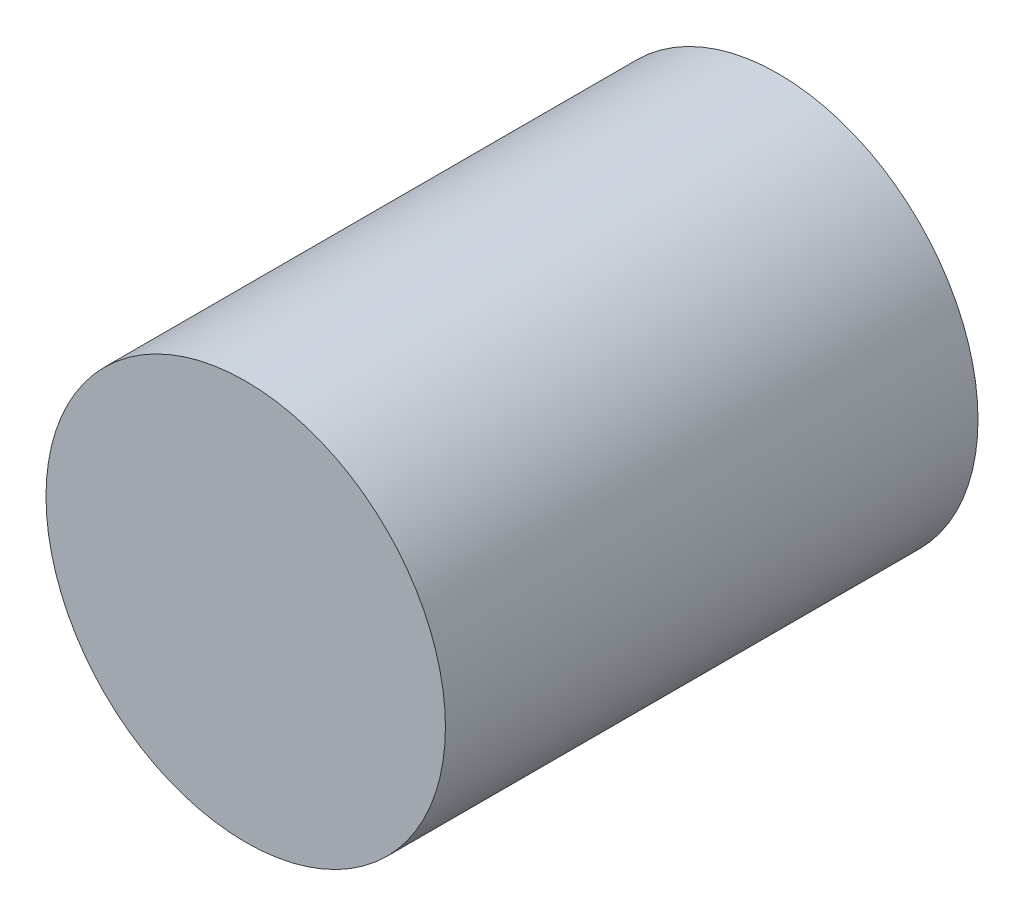
from build123d import *

# Parameters (mm, degrees)
SKETCH_1_R      = 7.5
EXTRUDE_1_DEPTH = 10


with BuildPart() as part:
    # 草图1 → 凸台-拉伸1 (new, symmetric)
    with BuildSketch(Plane.XY):
        Circle(SKETCH_1_R)
    extrude(amount=EXTRUDE_1_DEPTH, both=True)


solid = part.part
